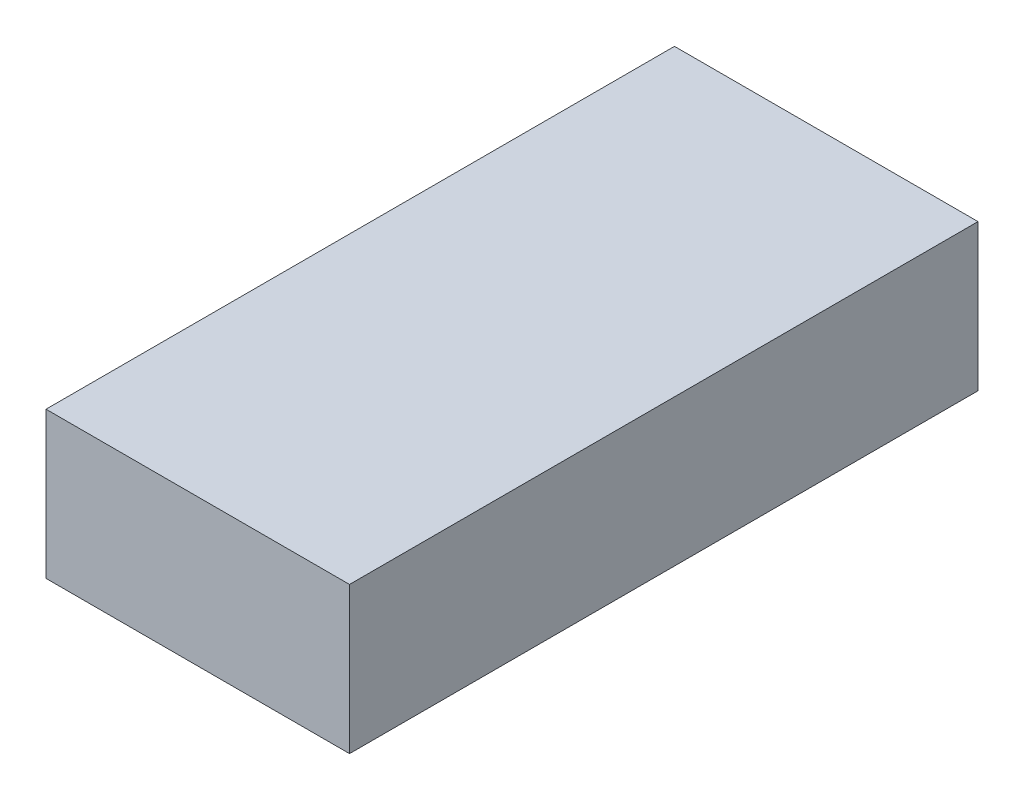
from build123d import *

# Parameters (mm, degrees)
SKETCH2_W           = 52.4
SKETCH2_H           = 25.3
BOSS_EXTRUDE1_DEPTH = 108.5


with BuildPart() as part:
    # Sketch2 → Boss-Extrude1 (new body)
    with BuildSketch(Plane.XY):
        with Locations((26.2, 12.65)):
            Rectangle(SKETCH2_W, SKETCH2_H)
    extrude(amount=BOSS_EXTRUDE1_DEPTH)


solid = part.part
